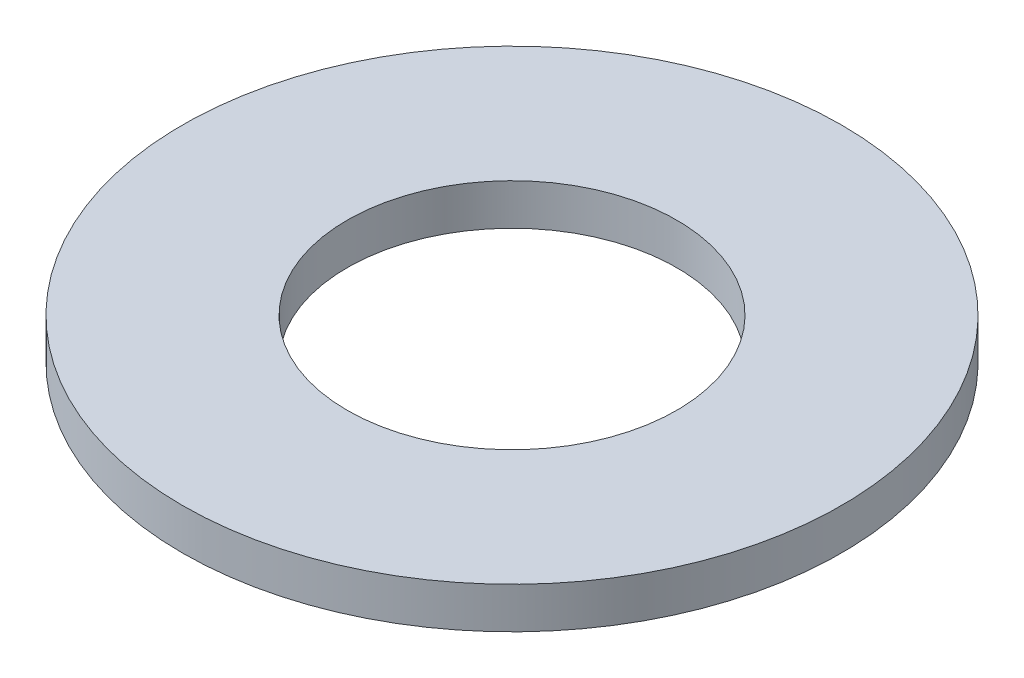
from build123d import *

# Parameters (mm, degrees)
SKETCH1_R           = 2
SKETCH1_R_2         = 1
BOSS_EXTRUDE1_DEPTH = 0.25


with BuildPart() as part:
    # Sketch1 → Boss-Extrude1 (new body)
    with BuildSketch(Plane(origin=(0, 0, 0), x_dir=(1, 0, 0), z_dir=(0, 1, 0))):
        with Locations(Location((0, 0, 0), (0, 0, 270))):
            Circle(SKETCH1_R)
        with Locations(Location((0, 0, 0), (0, 0, 270))):
            Circle(SKETCH1_R_2, mode=Mode.SUBTRACT)
    extrude(amount=BOSS_EXTRUDE1_DEPTH)


solid = part.part
